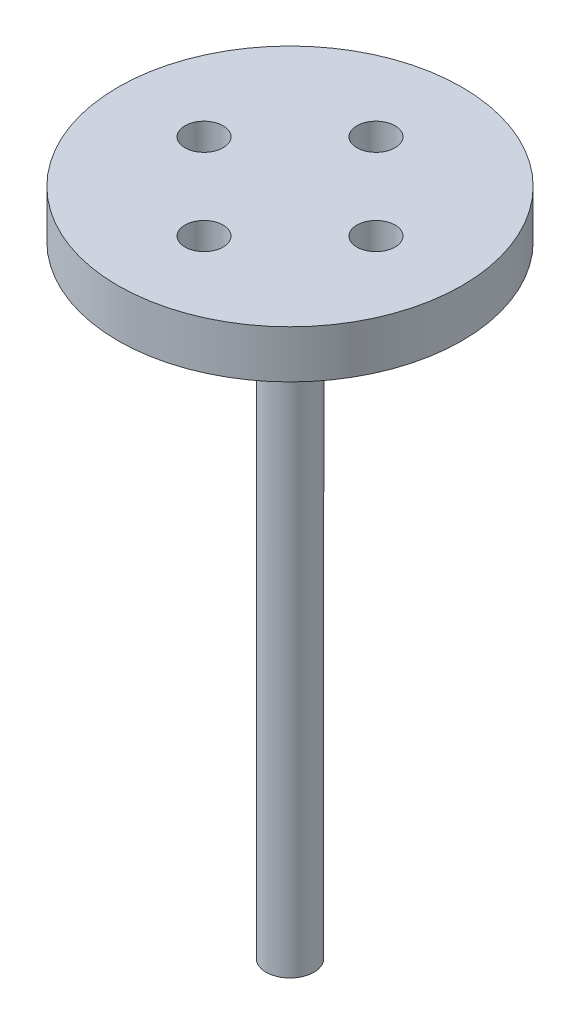
from build123d import *

# Parameters (mm, degrees)
SKETCH_1_R      = 18
SKETCH_1_R_2    = 2
EXTRUDE_1_DEPTH = 5
SKETCH_2_R      = 2.5
EXTRUDE_2_DEPTH = 65


with BuildPart() as part:
    # 草图1 → 凸台-拉伸1 (new body)
    with BuildSketch(Plane(origin=(0, 0, 0), x_dir=(1, 0, 0), z_dir=(0, 1, 0))):
        with Locations(Location((0, 0, 0), (0, 0, 270))):
            Circle(SKETCH_1_R)
        with Locations(Location((0, 9, 0), (0, 0, 270))):
            Circle(SKETCH_1_R_2, mode=Mode.SUBTRACT)
        with Locations(Location((9, 0, 0), (0, 0, 270))):
            Circle(SKETCH_1_R_2, mode=Mode.SUBTRACT)
        with Locations(Location((-9, 0, 0), (0, 0, 270))):
            Circle(SKETCH_1_R_2, mode=Mode.SUBTRACT)
        with Locations(Location((0, -9, 0), (0, 0, 270))):
            Circle(SKETCH_1_R_2, mode=Mode.SUBTRACT)
    extrude(amount=EXTRUDE_1_DEPTH)

    # 草图2 → 凸台-拉伸2 (add)
    with BuildSketch(Plane.XZ):
        with Locations(Location((0, 0, 0), (0, 0, 90))):
            Circle(SKETCH_2_R)
    extrude(amount=EXTRUDE_2_DEPTH)


solid = part.part
